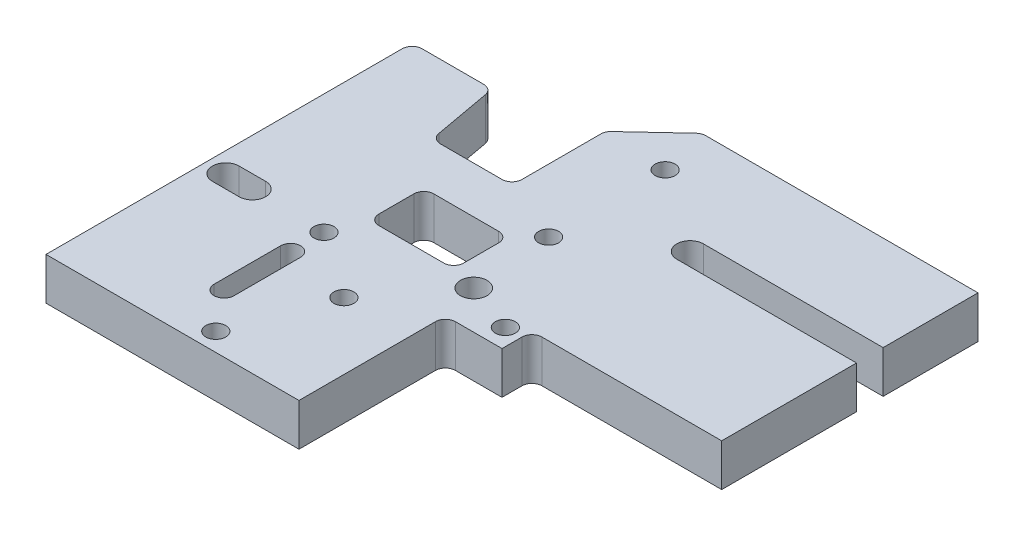
from build123d import *

# Parameters (mm, degrees)
SKETCH1_R               = 1.5
SKETCH1_R_2             = 3
SKETCH1_R_3             = 2
SKETCH1_W               = 12.75
SKETCH1_H               = 8.25
BOSS_EXTRUDE1_DEPTH     = 6.35
FILLET1_R               = 1.5
SKETCH3_W               = 129.678218063
SKETCH3_H               = 13.276015012
CUT_EXTRUDE1_DEPTH      = 56
SKETCH4_W               = 14.25
SKETCH4_H               = 6.35
SKETCH4_W_2             = 20.25
SKETCH4_W_3             = 16.5
BOSS_EXTRUDE2_DEPTH     = 25
SKETCH5_W               = 158.83803675
SKETCH5_H               = 69.224935419
CUT_EXTRUDE2_DEPTH      = 86
CUT_EXTRUDE3_DEPTH      = 10
CUT_EXTRUDE3_DEPTH_BACK = 49
SKETCH6_W               = 0.1
SKETCH6_H               = 6.35
SKETCH7_W               = 88.464513538
SKETCH7_H               = 23.115624737
CUT_EXTRUDE4_DEPTH      = 68


with BuildPart() as part:
    # Sketch1 → Boss-Extrude1 (new body)
    with BuildSketch(Plane(origin=(0, 0, 0), x_dir=(1, 0, 0), z_dir=(0, 1, 0))):
        Polygon((0, 20), (0, 104), (12, 104), (14, 93), (26, 93), (26, 107), (33.5, 114), (62.5, 114), (70, 107), (70, 93), (82, 93), (84, 104), (96, 104), (96, 20), (89, 9), (89, 0), (62, 0), (62, 8), (34, 8), (34, 0), (7, 0), (7, 9), align=None)
        with Locations(Location((12.5, 3, 0), (0, 0, 270))):
            Circle(SKETCH1_R, mode=Mode.SUBTRACT)
        with Locations(Location((28, 3, 0), (0, 0, 270))):
            Circle(SKETCH1_R, mode=Mode.SUBTRACT)
        with Locations(Location((68, 3, 0), (0, 0, 90))):
            Circle(SKETCH1_R, mode=Mode.SUBTRACT)
        with Locations(Location((83.5, 3, 0), (0, 0, 90))):
            Circle(SKETCH1_R, mode=Mode.SUBTRACT)
        with Locations(Location((14, 13, 0), (0, 0, 270))):
            Circle(SKETCH1_R_2, mode=Mode.SUBTRACT)
        with Locations(Location((27, 13, 0), (0, 0, 270))):
            Circle(SKETCH1_R_2, mode=Mode.SUBTRACT)
        with Locations(Location((69, 13, 0), (0, 0, 90))):
            Circle(SKETCH1_R_2, mode=Mode.SUBTRACT)
        with Locations(Location((82, 13, 0), (0, 0, 90))):
            Circle(SKETCH1_R_2, mode=Mode.SUBTRACT)
        with Locations(Location((22.75, 42.455027657, 0), (0, 0, 270))):
            Circle(SKETCH1_R, mode=Mode.SUBTRACT)
        with Locations(Location((22.75, 51.751081058, 0), (0, 0, 270))):
            Circle(SKETCH1_R, mode=Mode.SUBTRACT)
        with Locations(Location((73.25, 42.455027657, 0), (0, 0, 90))):
            Circle(SKETCH1_R, mode=Mode.SUBTRACT)
        with Locations(Location((73.25, 51.751081058, 0), (0, 0, 90))):
            Circle(SKETCH1_R, mode=Mode.SUBTRACT)
        with Locations(Location((18, 72.75, 0), (0, 0, 270))):
            Circle(SKETCH1_R, mode=Mode.SUBTRACT)
        with Locations(Location((28, 65.75, 0), (0, 0, 270))):
            Circle(SKETCH1_R, mode=Mode.SUBTRACT)
        with Locations(Location((68, 65.75, 0), (0, 0, 90))):
            Circle(SKETCH1_R, mode=Mode.SUBTRACT)
        with Locations(Location((78, 72.75, 0), (0, 0, 90))):
            Circle(SKETCH1_R, mode=Mode.SUBTRACT)
        with Locations(Location((36.5, 76.75, 0), (0, 0, 270))):
            Circle(SKETCH1_R_3, mode=Mode.SUBTRACT)
        with Locations(Location((59.5, 76.75, 0), (0, 0, 90))):
            Circle(SKETCH1_R_3, mode=Mode.SUBTRACT)
        with Locations(Location((35.5, 89, 0), (0, 0, 270))):
            Circle(SKETCH1_R, mode=Mode.SUBTRACT)
        with Locations(Location((35.5, 106.5, 0), (0, 0, 270))):
            Circle(SKETCH1_R, mode=Mode.SUBTRACT)
        with Locations(Location((60.5, 89, 0), (0, 0, 90))):
            Circle(SKETCH1_R, mode=Mode.SUBTRACT)
        with Locations(Location((60.5, 106.5, 0), (0, 0, 90))):
            Circle(SKETCH1_R, mode=Mode.SUBTRACT)
        with Locations(Location((44, 26, 0), (0, 0, 270))):
            Circle(SKETCH1_R, mode=Mode.SUBTRACT)
        with Locations(Location((52, 26, 0), (0, 0, 90))):
            Circle(SKETCH1_R, mode=Mode.SUBTRACT)
        with Locations(Location((52, 74, 0), (0, 0, 270))):
            Circle(SKETCH1_R, mode=Mode.SUBTRACT)
        with Locations(Location((44, 74, 0), (0, 0, 90))):
            Circle(SKETCH1_R, mode=Mode.SUBTRACT)
        with Locations(Location((48, 97.75, 0), (0, 0, 270))):
            Circle(SKETCH1_R_3, mode=Mode.SUBTRACT)
        with Locations((69.875, 25.875)):
            Rectangle(SKETCH1_W, SKETCH1_H, mode=Mode.SUBTRACT)
        with Locations((26.125, 25.875)):
            Rectangle(SKETCH1_W, SKETCH1_H, mode=Mode.SUBTRACT)
        with Locations((69.875, 81.875)):
            Rectangle(SKETCH1_W, SKETCH1_H, mode=Mode.SUBTRACT)
        with Locations((26.125, 81.875)):
            Rectangle(SKETCH1_W, SKETCH1_H, mode=Mode.SUBTRACT)
        with BuildLine():
            Line((3, 75), (7, 75))
            ThreePointArc((7, 75), (9, 73), (7, 71))
            Line((7, 71), (3, 71))
            ThreePointArc((3, 71), (1, 73), (3, 75))
        make_face(mode=Mode.SUBTRACT)
        with BuildLine():
            Line((93, 75), (89, 75))
            ThreePointArc((89, 75), (87, 73), (89, 71))
            Line((89, 71), (93, 71))
            ThreePointArc((93, 71), (95, 73), (93, 75))
        make_face(mode=Mode.SUBTRACT)
        with BuildLine():
            Line((93, 37), (89, 37))
            ThreePointArc((89, 37), (87, 35), (89, 33))
            Line((89, 33), (93, 33))
            ThreePointArc((93, 33), (95, 35), (93, 37))
        make_face(mode=Mode.SUBTRACT)
        with BuildLine():
            Line((3, 33), (7, 33))
            ThreePointArc((7, 33), (9, 35), (7, 37))
            Line((7, 37), (3, 37))
            ThreePointArc((3, 37), (1, 35), (3, 33))
        make_face(mode=Mode.SUBTRACT)
        with BuildLine():
            Line((15, 48.525154469), (23, 48.525154469))
            ThreePointArc((23, 48.525154469), (24.5, 47.025154469), (23, 45.525154469))
            Line((23, 45.525154469), (15, 45.525154469))
            ThreePointArc((15, 45.525154469), (13.5, 47.025154469), (15, 48.525154469))
        make_face(mode=Mode.SUBTRACT)
        with BuildLine():
            Line((81, 48.525154469), (73, 48.525154469))
            ThreePointArc((73, 48.525154469), (71.5, 47.025154469), (73, 45.525154469))
            Line((73, 45.525154469), (81, 45.525154469))
            ThreePointArc((81, 45.525154469), (82.5, 47.025154469), (81, 48.525154469))
        make_face(mode=Mode.SUBTRACT)
        with BuildLine():
            Line((16.5, 67.75), (16.5, 57.75))
            ThreePointArc((16.5, 57.75), (18, 56.25), (19.5, 57.75))
            Line((19.5, 57.75), (19.5, 67.75))
            ThreePointArc((19.5, 67.75), (18, 69.25), (16.5, 67.75))
        make_face(mode=Mode.SUBTRACT)
        with BuildLine():
            Line((76.5, 67.75), (76.5, 57.75))
            ThreePointArc((76.5, 57.75), (78, 56.25), (79.5, 57.75))
            Line((79.5, 57.75), (79.5, 67.75))
            ThreePointArc((79.5, 67.75), (78, 69.25), (76.5, 67.75))
        make_face(mode=Mode.SUBTRACT)
        with BuildLine():
            Line((46.5, 29), (38, 29))
            Line((38, 29), (38, 71))
            Line((38, 71), (46.5, 71))
            Line((46.5, 71), (46.5, 74))
            ThreePointArc((46.5, 74), (48, 75.5), (49.5, 74))
            Line((49.5, 74), (49.5, 71))
            Line((49.5, 71), (58, 71))
            Line((58, 71), (58, 29))
            Line((58, 29), (49.5, 29))
            Line((49.5, 29), (49.5, 26))
            ThreePointArc((49.5, 26), (48, 24.5), (46.5, 26))
            Line((46.5, 26), (46.5, 29))
        make_face(mode=Mode.SUBTRACT)
    extrude(amount=BOSS_EXTRUDE1_DEPTH)

    # Fillet1
    fillet1_edges = [part.edges().sort_by_distance(p)[0] for p in [
        (19.75, 3.175, -30),
        (19.75, 3.175, -21.75),
        (32.5, 3.175, -21.75),
        (32.5, 3.175, -30),
        (63.5, 3.175, -77.75),
        (76.25, 3.175, -77.75),
        (76.25, 3.175, -86),
        (63.5, 3.175, -86),
        (19.75, 3.175, -86),
        (19.75, 3.175, -77.75),
        (32.5, 3.175, -77.75),
        (32.5, 3.175, -86),
        (58, 3.175, -29),
        (58, 3.175, -71),
        (38, 3.175, -71),
        (38, 3.175, -29),
        (62, 3.175, -8),
        (34, 3.175, -8),
        (34, 3.175, 0),
        (7, 3.175, 0),
        (7, 3.175, -9),
        (0, 3.175, -20),
        (0, 3.175, -104),
        (12, 3.175, -104),
        (14, 3.175, -93),
        (26, 3.175, -93),
        (26, 3.175, -107),
        (33.5, 3.175, -114),
        (62.5, 3.175, -114),
        (70, 3.175, -107),
        (70, 3.175, -93),
        (82, 3.175, -93),
        (84, 3.175, -104),
        (96, 3.175, -104),
        (96, 3.175, -20),
        (89, 3.175, -9),
        (89, 3.175, 0),
        (62, 3.175, 0),
        (76.25, 3.175, -21.75),
        (76.25, 3.175, -30),
        (63.5, 3.175, -30),
        (63.5, 3.175, -21.75),
    ]]
    fillet(fillet1_edges, radius=FILLET1_R)

    # Sketch3 → Cut-Extrude1 (cut)
    with BuildSketch(Plane(origin=(48, 0, 0), x_dir=(0, 0, -1), z_dir=(1, 0, 0))):
        with Locations((58.42243018, 0.940732076)):
            Rectangle(SKETCH3_W, SKETCH3_H)
    extrude(amount=CUT_EXTRUDE1_DEPTH, mode=Mode.SUBTRACT)

    # Sketch4 → Boss-Extrude2 (add)
    with BuildSketch(Plane(origin=(48, 0, 0), x_dir=(0, 0, -1), z_dir=(1, 0, 0))):
        with Locations((106.875, 3.175)):
            Rectangle(SKETCH4_W, SKETCH4_H)
        with Locations((85.625, 3.175)):
            Rectangle(SKETCH4_W_2, SKETCH4_H)
        with Locations((16.25, 3.175)):
            Rectangle(SKETCH4_W_3, SKETCH4_H)
    extrude(amount=BOSS_EXTRUDE2_DEPTH)

    # Mirror1: part across plane


with BuildPart() as part_1:
    add(part.part)
    add(part.part.mirror(Plane(origin=(73, 0, 0), x_dir=(0, 0, 1), z_dir=(1, 0, 0))))

    # Sketch5 → Cut-Extrude2 (cut)
    with BuildSketch(Plane(origin=(75, 0, 0), x_dir=(0, 0, -1), z_dir=(1, 0, 0))):
        with Locations((54.73207584, 3.767679241)):
            Rectangle(SKETCH5_W, SKETCH5_H)
    extrude(amount=CUT_EXTRUDE2_DEPTH, mode=Mode.SUBTRACT)

    # Sketch6 → Cut-Extrude3 (cut, two sides: drawn at the far end of the back side and taken through both)
    with BuildSketch(Plane(origin=(38, 0, 0), x_dir=(0, 0, -1), z_dir=(1, 0, 0)).offset(-CUT_EXTRUDE3_DEPTH_BACK)):
        with Locations((48.95, 3.175)):
            Rectangle(SKETCH6_W, SKETCH6_H)
    extrude(amount=CUT_EXTRUDE3_DEPTH + CUT_EXTRUDE3_DEPTH_BACK, mode=Mode.SUBTRACT)


with BuildPart() as cut_extrude3_piece_1:
    # of the separate pieces the step leaves, piece 1, a body of its own (cut_extrude3_pieces)
    add(part_1.part.solids().sort_by_distance((0, 0, -49))[0])


with BuildPart() as cut_extrude3_piece_2:
    # of the separate pieces the step leaves, piece 2, a body of its own (cut_extrude3_pieces)
    add(part_1.part.solids().sort_by_distance((0, 0, -20.436801031))[0])

    # Sketch7 → Cut-Extrude4 (cut)
    with BuildSketch(Plane(origin=(0, 0, -48.91), x_dir=(-1, 0, 0), z_dir=(0, 0, -1))):
        with Locations((-38.621683349, 5.173992705)):
            Rectangle(SKETCH7_W, SKETCH7_H)
    extrude(amount=-CUT_EXTRUDE4_DEPTH, mode=Mode.SUBTRACT)


solid = cut_extrude3_piece_1.part
